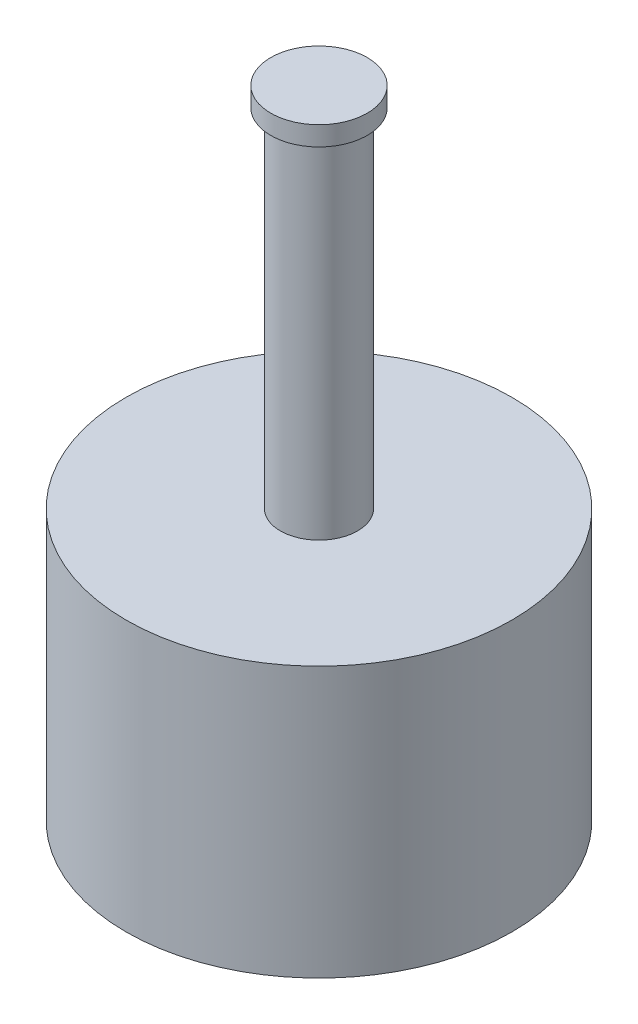
from build123d import *

# Parameters (mm, degrees)
BOSS_EXTRUDE1_START = 7
SKETCH2_R           = 2
BOSS_EXTRUDE1_DEPTH = 18
SKETCH3_R           = 10
BOSS_EXTRUDE2_DEPTH = 14
SKETCH4_R           = 8.5
SKETCH4_R_2         = 4
CUT_EXTRUDE1_DEPTH  = 0.5


with BuildPart() as part:
    # Sketch1 → Revolve1 (revolve)
    with BuildSketch(Plane.XY, mode=Mode.PRIVATE) as revolve1_sk:
        Polygon((0, 12), (2.5, 12), (2.5, 11), (2, 11), (2, 0), (0, 0), align=None)
    revolve(revolve1_sk.sketch.rotate(Axis((0, 0, 0), (0, 1, 0)), 90), axis=Axis((0, 0, 0), (0, 1, 0)))

    # Sketch2 → Boss-Extrude1 (add)
    with BuildSketch(Plane.XZ.offset(BOSS_EXTRUDE1_START)):
        with Locations(Location((0, 0, 0), (0, 0, 270))):
            Circle(SKETCH2_R)
    extrude(amount=-BOSS_EXTRUDE1_DEPTH)

    # Sketch3 → Boss-Extrude2 (add)
    with BuildSketch(Plane.XZ.offset(7)):
        with Locations(Location((0, 0, 0), (0, 0, 270))):
            Circle(SKETCH3_R)
    extrude(amount=BOSS_EXTRUDE2_DEPTH)

    # Sketch4 → Cut-Extrude1 (cut)
    with BuildSketch(Plane.XZ.offset(21)):
        with Locations(Location((0, 0, 0), (0, 0, 270))):
            Circle(SKETCH4_R)
        with Locations(Location((0, 0, 0), (0, 0, 270))):
            Circle(SKETCH4_R_2, mode=Mode.SUBTRACT)
    extrude(amount=-CUT_EXTRUDE1_DEPTH, mode=Mode.SUBTRACT)


solid = part.part
